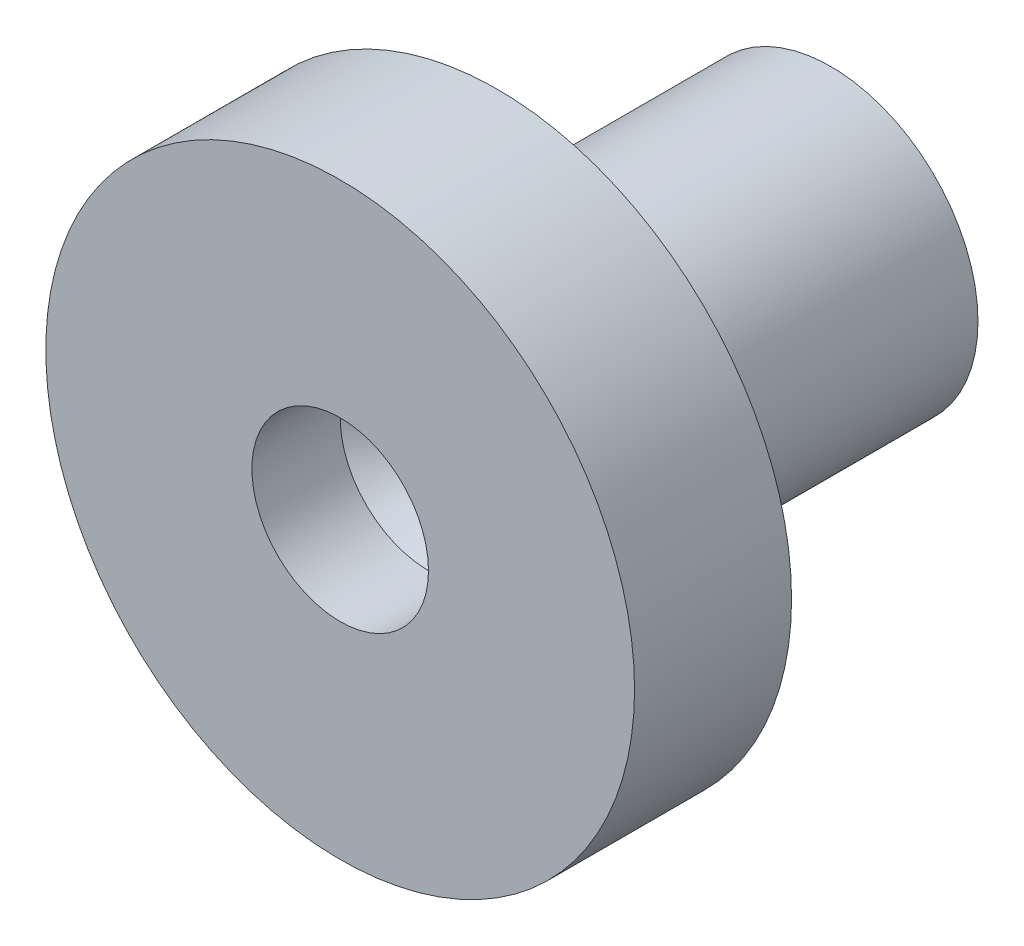
from build123d import *

# Parameters (mm, degrees)
SKETCH_1_R          = 7.5
SKETCH_1_R_2        = 4.35
EXTRUDE_1_DEPTH     = 17
SKETCH_3_R          = 6
CUT_EXTRUDE_2_DEPTH = 3
SKETCH_4_R          = 7.5
EXTRUDE_3_DEPTH     = 8
SKETCH_5_R          = 1.25
CUT_EXTRUDE_4_DEPTH = 13.5
SKETCH_6_R          = 4.5
CUT_EXTRUDE_5_DEPTH = 4.5
SKETCH_7_R          = 4.5
CUT_EXTRUDE_6_DEPTH = 2.5
CUT_EXTRUDE_6_DRAFT = -50
EXTRUDE_START       = -8
SKETCH_8_R          = 15
SKETCH_8_R_2        = 7.5
EXTRUDE_8_DEPTH     = 8
FILLET_1_R          = 3


with BuildPart() as part:
    # Эскиз1 → Вытянуть1 (new body)
    with BuildSketch(Plane.XY):
        Circle(SKETCH_1_R)
        Circle(SKETCH_1_R_2, mode=Mode.SUBTRACT)
    extrude(amount=EXTRUDE_1_DEPTH)

    # Эскиз3 → Вытянуть2 (cut)
    with BuildSketch(Plane(origin=(0, 0, 0), x_dir=(-1, 0, 0), z_dir=(0, 0, -1))):
        Circle(SKETCH_3_R)
    extrude(amount=-CUT_EXTRUDE_2_DEPTH, mode=Mode.SUBTRACT)

    # Эскиз4 → Вытянуть3 (add)
    with BuildSketch(Plane.XY.offset(17)):
        Circle(SKETCH_4_R)
    extrude(amount=EXTRUDE_3_DEPTH)

    # Эскиз5 → Вытянуть4 (cut, symmetric)
    with BuildSketch(Plane.XY.offset(25)):
        Circle(SKETCH_5_R)
    extrude(amount=CUT_EXTRUDE_4_DEPTH, both=True, mode=Mode.SUBTRACT)

    # Эскиз6 → Вытянуть5 (cut)
    with BuildSketch(Plane.XY.offset(25)):
        Circle(SKETCH_6_R)
    extrude(amount=-CUT_EXTRUDE_5_DEPTH, mode=Mode.SUBTRACT)


with BuildPart() as cut_extrude_6_tool:
    # Эскиз7 → Вытянуть6 (with draft: the straight prism first)
    with BuildSketch(Plane.XY.offset(20.5)):
        Circle(SKETCH_7_R)
    extrude(amount=-CUT_EXTRUDE_6_DEPTH)
    # Вытянуть6: the draft: its side faces are tilted about the plane it starts from
    cut_extrude_6_sides = [cut_extrude_6_tool.faces().sort_by_distance(p)[0] for p in [
        (-4.5, 0, 19.25),
    ]]
    draft(cut_extrude_6_sides, Plane.XY.offset(20.5), CUT_EXTRUDE_6_DRAFT)


with BuildPart() as part_1:
    add(part.part)

    # Вытянуть6: cut by cut_extrude_6_tool
    add(cut_extrude_6_tool.part, mode=Mode.SUBTRACT)

    # Эскиз8 → Вытянуть8 (add)
    with BuildSketch(Plane.XY.offset(25).offset(EXTRUDE_START)):
        Circle(SKETCH_8_R)
        Circle(SKETCH_8_R_2, mode=Mode.SUBTRACT)
    extrude(amount=EXTRUDE_8_DEPTH)

    # Скругление1
    fillet_1_edges = [part_1.edges().sort_by_distance(p)[0] for p in [
        (-7.5, 0, 17),
    ]]
    fillet(fillet_1_edges, radius=FILLET_1_R)


solid = part_1.part
